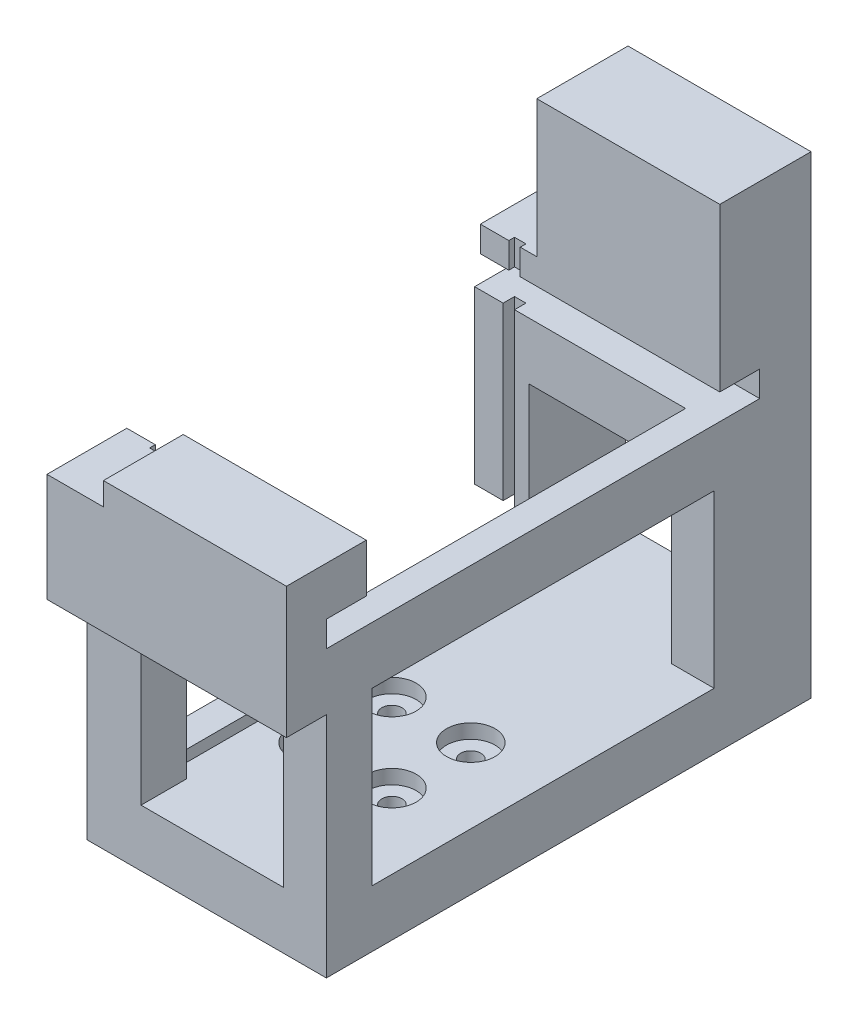
from build123d import *

# Parameters (mm, degrees)
SKETCH1_W            = 40
SKETCH1_H            = 76
BOSS_EXTRUDE1_DEPTH  = 10
SKETCH2_W            = 40
SKETCH2_H            = 76
SKETCH2_W_2          = 30
SKETCH2_H_2          = 60
BOSS_EXTRUDE2_DEPTH  = 40
SKETCH3_W            = 25
SKETCH3_H            = 30
CUT_EXTRUDE1_DEPTH   = 100.37806599
SKETCH4_W            = 60
SKETCH4_H            = 30
CUT_EXTRUDE2_DEPTH   = 100.37806599
SKETCH9_R            = 1.778
SKETCH9_R_2          = 1.778000002
CUT_EXTRUDE4_DEPTH   = 40
BOSS_EXTRUDE4_START  = -10
SKETCH12_R           = 1.778
BOSS_EXTRUDE4_DEPTH  = 10
SKETCH13_W           = 40
SKETCH13_H           = 10
BOSS_EXTRUDE5_DEPTH  = 7
SKETCH14_W           = 40
SKETCH14_H           = 10
BOSS_EXTRUDE6_DEPTH  = 7
SKETCH16_W           = 40
SKETCH16_H           = 7
BOSS_EXTRUDE7_DEPTH  = 4.5
SKETCH17_W           = 40
SKETCH17_H           = 4.5
BOSS_EXTRUDE8_DEPTH  = 14
SKETCH18_W           = 40
SKETCH18_H           = 4.5
BOSS_EXTRUDE9_DEPTH  = 14
SKETCH19_W           = 40
SKETCH19_H           = 19
BOSS_EXTRUDE10_DEPTH = 2
BOSS_EXTRUDE11_DEPTH = 9
CUT_EXTRUDE6_START   = -7.5
SKETCH21_W           = 9
SKETCH21_H           = 10
CUT_EXTRUDE6_DEPTH   = 7.5
BOSS_EXTRUDE13_DEPTH = 2
CUT_EXTRUDE7_START   = -49
SKETCH25_W           = 2
SKETCH25_H           = 64
CUT_EXTRUDE7_DEPTH   = 49
SKETCH26_W           = 2
SKETCH26_H           = 64
CUT_EXTRUDE8_DEPTH   = 42
SKETCH27_W           = 60
SKETCH27_H           = 10
CUT_EXTRUDE10_DEPTH  = 10
SKETCH28_W           = 32.101148564
SKETCH28_H           = 16
BOSS_EXTRUDE14_DEPTH = 24
SKETCH29_W           = 32.101148564
SKETCH29_H           = 14
BOSS_EXTRUDE15_DEPTH = 4
SKETCH30_R           = 4.25
CUT_EXTRUDE11_DEPTH  = 2.5


with BuildPart() as part:
    # Sketch1 → Boss-Extrude1 (new body)
    with BuildSketch(Plane(origin=(0, 0, 0), x_dir=(1, 0, 0), z_dir=(0, 1, 0))):
        with Locations((20, 38)):
            Rectangle(SKETCH1_W, SKETCH1_H)
    extrude(amount=BOSS_EXTRUDE1_DEPTH)

    # Sketch2 → Boss-Extrude2 (add)
    with BuildSketch(Plane(origin=(0, 10, 0), x_dir=(1, 0, 0), z_dir=(0, 1, 0))):
        with Locations((20, 38)):
            Rectangle(SKETCH2_W, SKETCH2_H)
        with Locations((20, 38)):
            Rectangle(SKETCH2_W_2, SKETCH2_H_2, mode=Mode.SUBTRACT)
    extrude(amount=BOSS_EXTRUDE2_DEPTH)

    # Sketch3 → Cut-Extrude1 (cut, through all)
    with BuildSketch(Plane.XY):
        with Locations((20, 25)):
            Rectangle(SKETCH3_W, SKETCH3_H)
    extrude(amount=-CUT_EXTRUDE1_DEPTH, mode=Mode.SUBTRACT)

    # Sketch4 → Cut-Extrude2 (cut, through all)
    with BuildSketch(Plane.ZY):
        with Locations((-38, 25)):
            Rectangle(SKETCH4_W, SKETCH4_H)
    extrude(amount=-CUT_EXTRUDE2_DEPTH, mode=Mode.SUBTRACT)

    # Sketch9 → Cut-Extrude4 (cut)
    with BuildSketch(Plane.XZ):
        with Locations(Location((26.914797213, -38.414797213, 0), (0, 0, 270))):
            Circle(SKETCH9_R)
        with Locations(Location((13.085202787, -24.585202787, 0), (0, 0, 270))):
            Circle(SKETCH9_R)
        with Locations(Location((26.914797213, -24.585202787, 0), (0, 0, 270))):
            Circle(SKETCH9_R)
        with Locations(Location((29.778999999, -31.5, 0), (0, 0, 270))):
            Circle(SKETCH9_R)
        with Locations(Location((13.085202787, -38.414797213, 0), (0, 0, 270))):
            Circle(SKETCH9_R_2)
    extrude(amount=-CUT_EXTRUDE4_DEPTH, mode=Mode.SUBTRACT)

    # Sketch12 → Boss-Extrude4 (add)
    with BuildSketch(Plane(origin=(0, 10, 0), x_dir=(1, 0, 0), z_dir=(0, 1, 0)).offset(BOSS_EXTRUDE4_START)):
        with Locations((29.778999999, 31.5)):
            Circle(SKETCH12_R)
    extrude(amount=BOSS_EXTRUDE4_DEPTH)

    # Sketch13 → Boss-Extrude5 (add)
    with BuildSketch(Plane.XY):
        with Locations((20, 45)):
            Rectangle(SKETCH13_W, SKETCH13_H)
    extrude(amount=BOSS_EXTRUDE5_DEPTH)

    # Sketch14 → Boss-Extrude6 (add)
    with BuildSketch(Plane(origin=(0, 0, -76), x_dir=(-1, 0, 0), z_dir=(0, 0, -1))):
        with Locations((-20, 45)):
            Rectangle(SKETCH14_W, SKETCH14_H)
    extrude(amount=BOSS_EXTRUDE6_DEPTH)

    # Sketch16 → Boss-Extrude7 (add)
    with BuildSketch(Plane(origin=(0, 50, 0), x_dir=(1, 0, 0), z_dir=(0, 1, 0))):
        with Locations((20, 79.5)):
            Rectangle(SKETCH16_W, SKETCH16_H)
        with Locations((20, -3.5)):
            Rectangle(SKETCH16_W, SKETCH16_H)
    extrude(amount=BOSS_EXTRUDE7_DEPTH)

    # Sketch17 → Boss-Extrude8 (add)
    with BuildSketch(Plane(origin=(0, 0, -83), x_dir=(-1, 0, 0), z_dir=(0, 0, -1))):
        with Locations((-20, 56.75)):
            Rectangle(SKETCH17_W, SKETCH17_H)
    extrude(amount=-BOSS_EXTRUDE8_DEPTH)

    # Sketch18 → Boss-Extrude9 (add)
    with BuildSketch(Plane.XY.offset(7)):
        with Locations((20, 56.75)):
            Rectangle(SKETCH18_W, SKETCH18_H)
    extrude(amount=-BOSS_EXTRUDE9_DEPTH)

    # Sketch19 → Boss-Extrude10 (add)
    with BuildSketch(Plane(origin=(0, 0, -83), x_dir=(-1, 0, 0), z_dir=(0, 0, -1))):
        with Locations((-20, 49.5)):
            Rectangle(SKETCH19_W, SKETCH19_H)
    extrude(amount=BOSS_EXTRUDE10_DEPTH)

    # Sketch20 → Boss-Extrude11 (add)
    with BuildSketch(Plane(origin=(0, 0, -76), x_dir=(-1, 0, 0), z_dir=(0, 0, -1))):
        Polygon((0, 40), (0, 0), (-40, 0), (-40, 40), (-32.5, 40), (-32.5, 10), (-7.5, 10), (-7.5, 40), align=None)
    extrude(amount=BOSS_EXTRUDE11_DEPTH)

    # Sketch21 → Cut-Extrude6 (cut)
    with BuildSketch(Plane.ZY.offset(CUT_EXTRUDE6_START)):
        with Locations((-72.5, 15)):
            Rectangle(SKETCH21_W, SKETCH21_H)
    extrude(amount=CUT_EXTRUDE6_DEPTH, mode=Mode.SUBTRACT)

    # Sketch23 → Boss-Extrude13 (add)
    with BuildSketch(Plane.ZY):
        Polygon((-69, 59), (-69, 54.5), (-76, 54.5), (-76, 50), (0, 50), (0, 54.5), (-7, 54.5), (-7, 59), (7, 59), (7, 40), (0, 40), (0, 0), (-85, 0), (-85, 59), align=None)
        Polygon((-68, 40), (-68, 20), (-77, 20), (-77, 10), (-76.5, 10), (-8, 10), (-8, 40), align=None, mode=Mode.SUBTRACT)
    extrude(amount=BOSS_EXTRUDE13_DEPTH)

    # Sketch25 → Cut-Extrude7 (cut)
    with BuildSketch(Plane(origin=(0, 59, 0), x_dir=(1, 0, 0), z_dir=(0, 1, 0)).offset(CUT_EXTRUDE7_START)):
        with Locations((4, 38)):
            Rectangle(SKETCH25_W, SKETCH25_H)
    extrude(amount=CUT_EXTRUDE7_DEPTH, mode=Mode.SUBTRACT)

    # Sketch26 → Cut-Extrude8 (cut)
    with BuildSketch(Plane(origin=(0, 50, 0), x_dir=(1, 0, 0), z_dir=(0, 1, 0))):
        with Locations((4, 38)):
            Rectangle(SKETCH26_W, SKETCH26_H)
    extrude(amount=-CUT_EXTRUDE8_DEPTH, mode=Mode.SUBTRACT)

    # Sketch27 → Cut-Extrude10 (cut)
    with BuildSketch(Plane.ZY.offset(2)):
        with Locations((-38, 45)):
            Rectangle(SKETCH27_W, SKETCH27_H)
    extrude(amount=-CUT_EXTRUDE10_DEPTH, mode=Mode.SUBTRACT)

    # Sketch28 → Boss-Extrude14 (add)
    with BuildSketch(Plane(origin=(0, 59, 0), x_dir=(1, 0, 0), z_dir=(0, 1, 0))):
        with Locations((23.949425718, 77)):
            Rectangle(SKETCH28_W, SKETCH28_H)
    extrude(amount=BOSS_EXTRUDE14_DEPTH)

    # Sketch29 → Boss-Extrude15 (add)
    with BuildSketch(Plane(origin=(0, 59, 0), x_dir=(1, 0, 0), z_dir=(0, 1, 0))):
        with Locations((23.949425718, 0)):
            Rectangle(SKETCH29_W, SKETCH29_H)
    extrude(amount=BOSS_EXTRUDE15_DEPTH)

    # Sketch30 → Cut-Extrude11 (cut)
    with BuildSketch(Plane(origin=(0, 10, 0), x_dir=(1, 0, 0), z_dir=(0, 1, 0))):
        with Locations(Location((13.085202787, 24.585202787, 0), (0, 0, 270))):
            Circle(SKETCH30_R)
        with Locations(Location((13.085202787, 38.414797213, 0), (0, 0, 270))):
            Circle(SKETCH30_R)
        with Locations(Location((26.914797213, 38.414797213, 0), (0, 0, 270))):
            Circle(SKETCH30_R)
        with Locations(Location((26.914797213, 24.585202787, 0), (0, 0, 270))):
            Circle(SKETCH30_R)
    extrude(amount=-CUT_EXTRUDE11_DEPTH, mode=Mode.SUBTRACT)


solid = part.part
